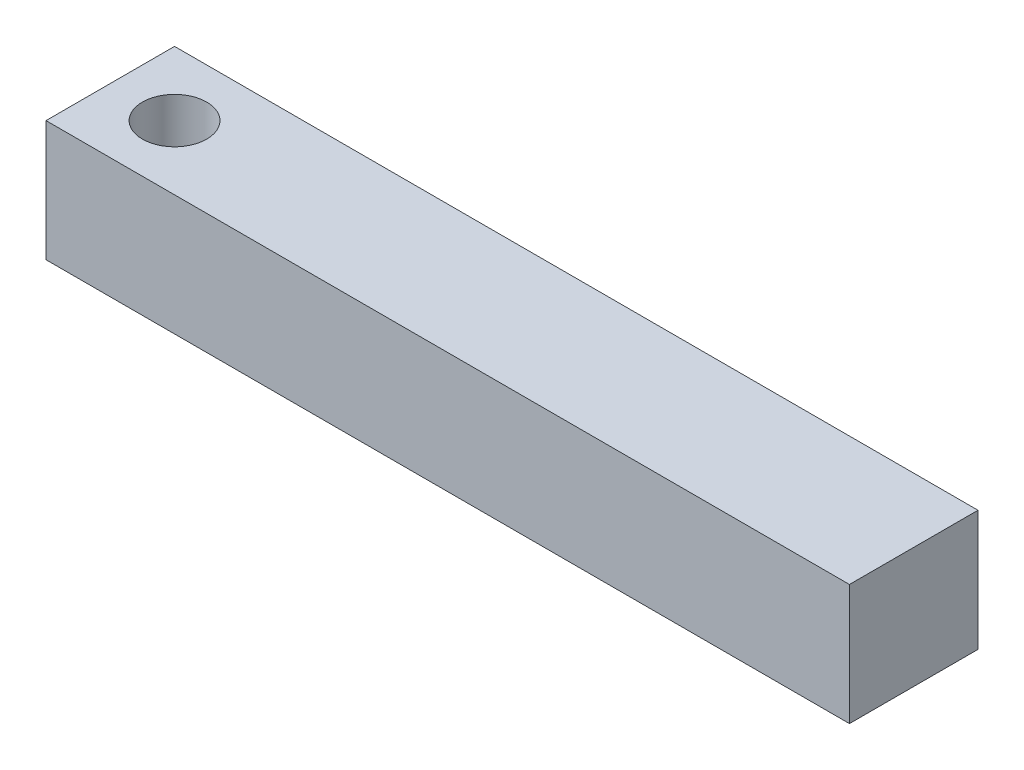
from build123d import *

# Parameters (mm, degrees)
ESBO_O1_W                = 100
ESBO_O1_H                = 16
ESBO_O1_R                = 4
RESSALTO_EXTRUS_O1_DEPTH = 15


with BuildPart() as part:
    # Esboço1 → Ressalto-extrusão1 (new body)
    with BuildSketch(Plane(origin=(0, 0, 0), x_dir=(1, 0, 0), z_dir=(0, 1, 0))):
        Rectangle(ESBO_O1_W, ESBO_O1_H)
        with Locations(Location((-42, 0, 0), (0, 0, 270))):
            Circle(ESBO_O1_R, mode=Mode.SUBTRACT)
    extrude(amount=RESSALTO_EXTRUS_O1_DEPTH)


solid = part.part
